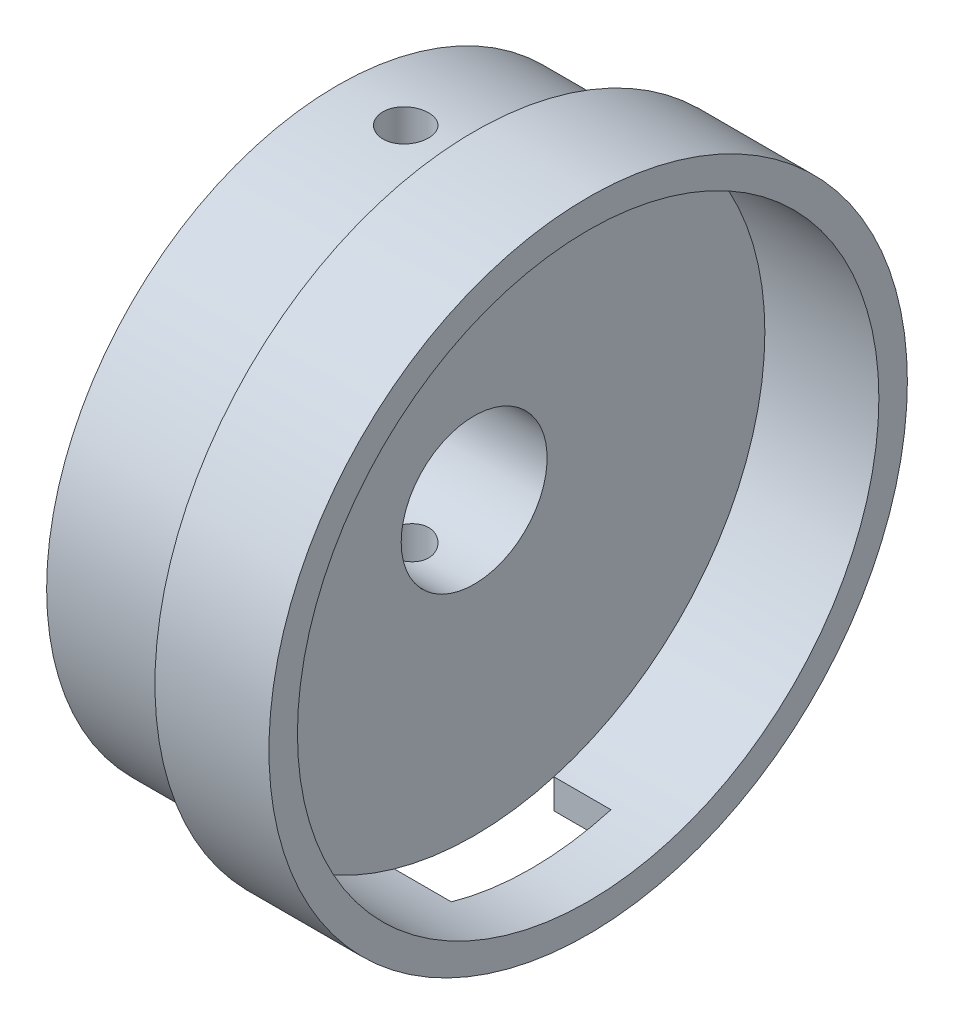
from build123d import *

# Parameters (mm, degrees)
SKETCH_1_R                      = 12.75
EXTRUDE_1_DEPTH                 = 6
SKETCH_2_R                      = 3.2
CUT_EXTRUDE_1_DEPTH             = 6
CUT_EXTRUDE_2_REACH             = 21.003
SKETCH_3_R                      = 1
CUT_EXTRUDE_2_DIRECTION_2_REACH = 21.003
SKETCH_4_R                      = 14
EXTRUDE_2_DEPTH                 = 5
CUT_EXTRUDE_START               = -5
SKETCH_5_R                      = 12.75
CUT_EXTRUDE_3_DEPTH             = 5
SKETCH_6_W                      = 2.5
SKETCH_6_H                      = 7
CUT_EXTRUDE_4_DEPTH             = 16


with BuildPart() as part:
    # 草图1 → 凸台-拉伸1 (new body)
    with BuildSketch(Plane(origin=(0, 0, 0), x_dir=(0, 0, -1), z_dir=(1, 0, 0))):
        Circle(SKETCH_1_R)
    extrude(amount=EXTRUDE_1_DEPTH)

    # 草图2 → 切除-拉伸1 (cut)
    with BuildSketch(Plane.ZY):
        Circle(SKETCH_2_R)
    extrude(amount=-CUT_EXTRUDE_1_DEPTH, mode=Mode.SUBTRACT)

    # 草图3 → 切除-拉伸2 (cut, up to next)
    with BuildSketch(Plane(origin=(0, 0, 0), x_dir=(1, 0, 0), z_dir=(0, 1, 0)), mode=Mode.PRIVATE) as cut_extrude_2_sk1:
        with Locations(Location((3, 0, 0), (0, 0, 270))):
            Circle(SKETCH_3_R)
    cut_extrude_2_tool1 = extrude(cut_extrude_2_sk1.sketch, amount=-CUT_EXTRUDE_2_REACH, mode=Mode.PRIVATE) & part.part
    add(cut_extrude_2_tool1.solids().sort_by_distance((3, 0, 0))[0], mode=Mode.SUBTRACT)

    # 草图3 → 切除-拉伸2 direction 2 (cut, up to next)
    with BuildSketch(Plane(origin=(0, 0, 0), x_dir=(1, 0, 0), z_dir=(0, 1, 0)), mode=Mode.PRIVATE) as cut_extrude_2_direction_2_sk1:
        with Locations(Location((3, 0, 0), (0, 0, 270))):
            Circle(SKETCH_3_R)
    cut_extrude_2_direction_2_tool1 = extrude(cut_extrude_2_direction_2_sk1.sketch, amount=CUT_EXTRUDE_2_DIRECTION_2_REACH, mode=Mode.PRIVATE) & part.part
    add(cut_extrude_2_direction_2_tool1.solids().sort_by_distance((3, 0, 0))[0], mode=Mode.SUBTRACT)

    # 草图4 → 凸台-拉伸2 (add)
    with BuildSketch(Plane(origin=(6, 0, 0), x_dir=(0, 0, -1), z_dir=(1, 0, 0))):
        Circle(SKETCH_4_R)
    extrude(amount=EXTRUDE_2_DEPTH)

    # 草图5 → 切除-拉伸3 (cut)
    with BuildSketch(Plane(origin=(11, 0, 0), x_dir=(0, 0, -1), z_dir=(1, 0, 0)).offset(CUT_EXTRUDE_START)):
        Circle(SKETCH_5_R)
    extrude(amount=CUT_EXTRUDE_3_DEPTH, mode=Mode.SUBTRACT)


with BuildPart() as cut_extrude_3_piece_1:
    # of the separate pieces the step leaves, piece 1, a body of its own (cut_extrude_3_pieces)
    add(part.part.solids().sort_by_distance((0, 0, -12.75))[0])


with BuildPart() as cut_extrude_3_piece_2:
    # of the separate pieces the step leaves, piece 2, a body of its own (cut_extrude_3_pieces)
    add(part.part.solids().sort_by_distance((6, 0, -14))[0])

    # 草图6 → 切除-拉伸4 (cut)
    with BuildSketch(Plane(origin=(0, 0, 0), x_dir=(1, 0, 0), z_dir=(0, 1, 0))):
        with Locations((7.25, 0)):
            Rectangle(SKETCH_6_W, SKETCH_6_H)
    extrude(amount=-CUT_EXTRUDE_4_DEPTH, mode=Mode.SUBTRACT)


solid = Compound([cut_extrude_3_piece_1.part, cut_extrude_3_piece_2.part])
